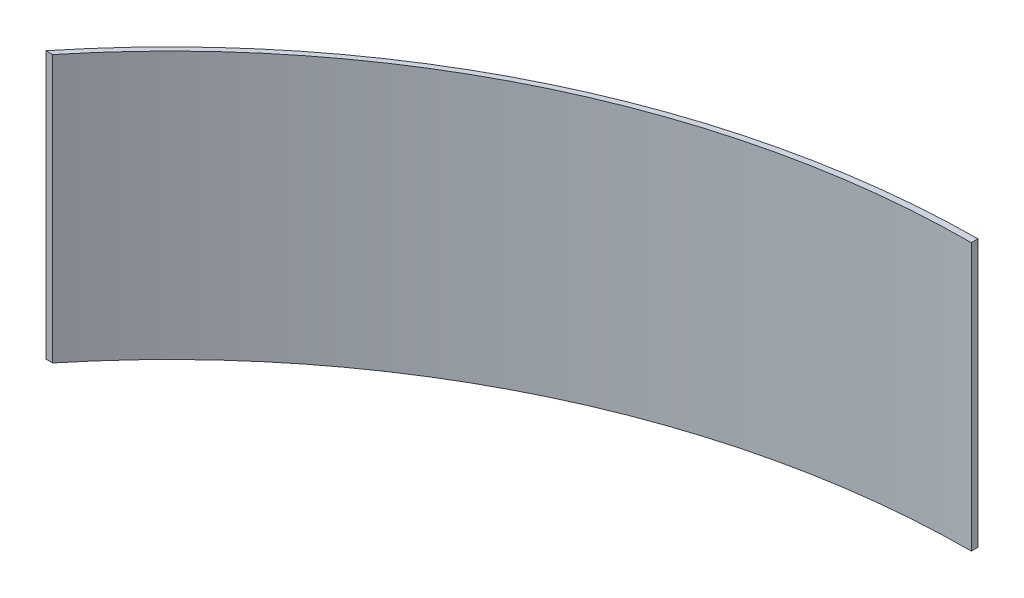
from build123d import *

# Parameters (mm, degrees)
SKETCH3_W           = 609.6
SKETCH3_H           = 304.8
BOSS_EXTRUDE1_DEPTH = 304.8
SKETCH4_W           = 609.6
SKETCH4_H           = 177.8
CUT_EXTRUDE1_DEPTH  = 609.6
SKETCH6_W           = 609.6
SKETCH6_H           = 609.6
CUT_EXTRUDE2_DEPTH  = 254


with BuildPart() as part:
    # Sketch3 → Boss-Extrude1 (new, symmetric)
    with BuildSketch(Plane.XY):
        Rectangle(SKETCH3_W, SKETCH3_H)
    extrude(amount=BOSS_EXTRUDE1_DEPTH, both=True)

    # Sketch4 → Cut-Extrude1 (cut)
    with BuildSketch(Plane(origin=(0, 0, -304.8), x_dir=(-1, 0, 0), z_dir=(0, 0, -1))):
        with Locations((0, -63.5)):
            Rectangle(SKETCH4_W, SKETCH4_H)
    extrude(amount=-CUT_EXTRUDE1_DEPTH, mode=Mode.SUBTRACT)

    # Sketch6 → Cut-Extrude2 (cut)
    with BuildSketch(Plane(origin=(0, 152.4, 0), x_dir=(1, 0, 0), z_dir=(0, 1, 0))):
        Rectangle(SKETCH6_W, SKETCH6_H)
        with BuildLine():
            Line((59.856357946, 27.628202152), (59.856357946, 30.803202152))
            ThreePointArc((59.856357946, 30.803202152), (-105.908299402, -7.521579235), (-239.166769949, -113.299131305))
            Line((-239.166769949, -113.299131305), (-235.991769949, -113.299131305))
            ThreePointArc((-235.991769949, -113.299131305), (-103.99313709, -9.40327752), (59.856357946, 27.628202152))
        make_face(mode=Mode.SUBTRACT)
    extrude(amount=-CUT_EXTRUDE2_DEPTH, mode=Mode.SUBTRACT)


solid = part.part
